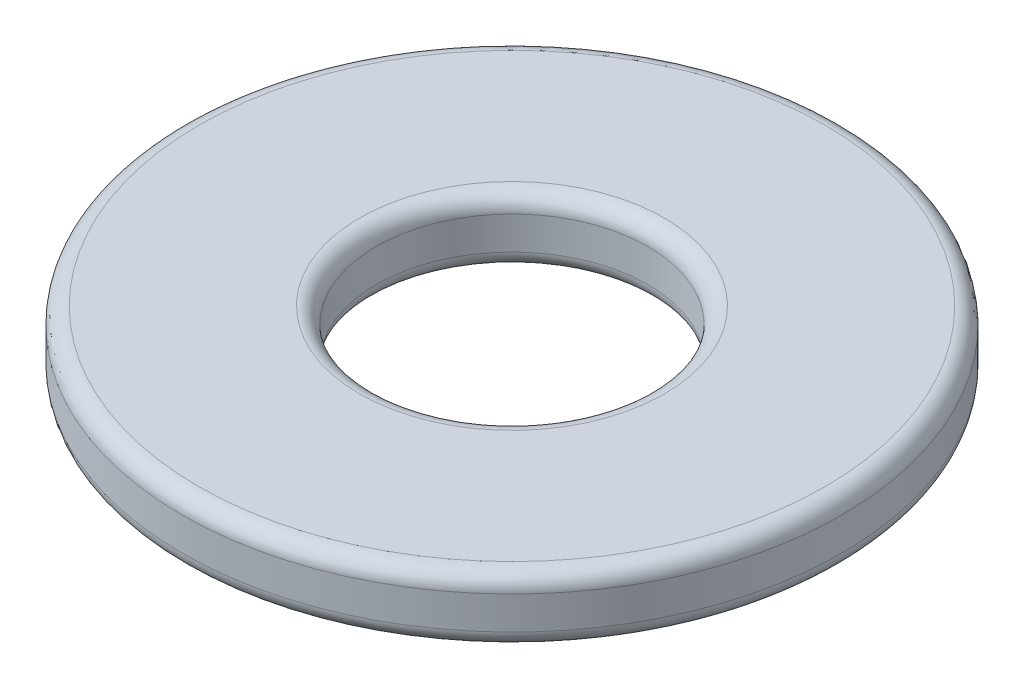
from build123d import *

# Parameters (mm, degrees)
MAIN_SKETCH_R     = 4
MAIN_SKETCH_R_2   = 1.65
WASHER_MAIN_DEPTH = 0.8
EDGE_FILLETS_R    = 0.2


with BuildPart() as part:
    # Main Sketch → Washer Main (new body)
    with BuildSketch(Plane(origin=(0, 0, 0), x_dir=(1, 0, 0), z_dir=(0, 1, 0))):
        with Locations(Location((0, 0, 0), (0, 0, 270))):
            Circle(MAIN_SKETCH_R)
        with Locations(Location((0, 0, 0), (0, 0, 270))):
            Circle(MAIN_SKETCH_R_2, mode=Mode.SUBTRACT)
    extrude(amount=WASHER_MAIN_DEPTH)

    # Edge Fillets
    edge_fillets_edges = [part.edges().sort_by_distance(p)[0] for p in [
        (0, 0, -4),
        (0, 0.8, -4),
        (0, 0, -1.65),
        (0, 0.8, -1.65),
    ]]
    fillet(edge_fillets_edges, radius=EDGE_FILLETS_R)


solid = part.part
